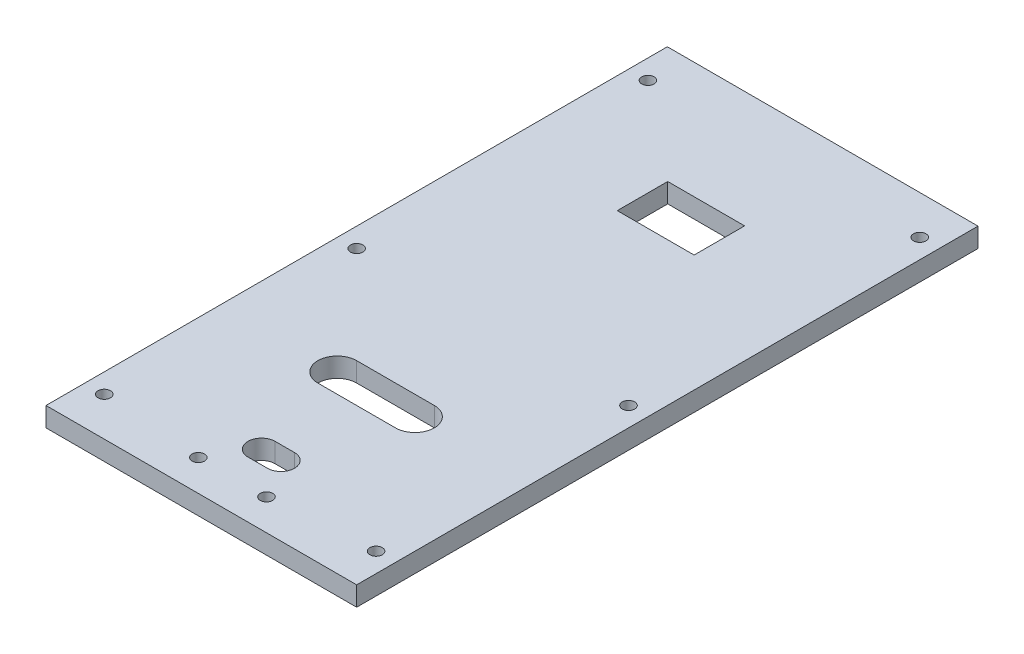
from build123d import *

# Parameters (mm, degrees)
ESQUISSE1_W              = 80
ESQUISSE1_H              = 160
BOSS_EXTRU_1_DEPTH       = 5
ESQUISSE2_R              = 1.6
ENL_V_MAT_EXTRU_8_DEPTH  = 10
ESQUISSE3_W              = 19.8
ESQUISSE3_H              = 13
ENL_V_MAT_EXTRU_9_DEPTH  = 10
ESQUISSE4_R              = 1.6
ENL_V_MAT_EXTRU_10_DEPTH = 10
ENL_V_MAT_EXTRU_11_DEPTH = 179.955301682
ENL_V_MAT_EXTRU_12_DEPTH = 179.955301682


with BuildPart() as part:
    # Esquisse1 → Boss.-Extru.1 (new body)
    with BuildSketch(Plane(origin=(0, 0, 0), x_dir=(1, 0, 0), z_dir=(0, 1, 0))):
        with Locations((40, 80)):
            Rectangle(ESQUISSE1_W, ESQUISSE1_H)
    extrude(amount=BOSS_EXTRU_1_DEPTH)

    # Esquisse2 → Enlèv. mat.-Extru.8 (cut)
    with BuildSketch(Plane(origin=(0, 0, 0), x_dir=(1, 0, 0), z_dir=(0, 1, 0))):
        with Locations(Location((5, 150, 0), (0, 0, 90))):
            Circle(ESQUISSE2_R)
        with Locations(Location((5, 75, 0), (0, 0, 90))):
            Circle(ESQUISSE2_R)
        with Locations(Location((5, 10, 0), (0, 0, 90))):
            Circle(ESQUISSE2_R)
        with Locations(Location((75, 10, 0), (0, 0, 90))):
            Circle(ESQUISSE2_R)
        with Locations(Location((75, 75, 0), (0, 0, 90))):
            Circle(ESQUISSE2_R)
        with Locations(Location((75, 150, 0), (0, 0, 90))):
            Circle(ESQUISSE2_R)
    extrude(amount=ENL_V_MAT_EXTRU_8_DEPTH, mode=Mode.SUBTRACT)

    # Esquisse3 → Enlèv. mat.-Extru.9 (cut)
    with BuildSketch(Plane(origin=(0, 0, 0), x_dir=(1, 0, 0), z_dir=(0, 1, 0))):
        with Locations((40, 123.5)):
            Rectangle(ESQUISSE3_W, ESQUISSE3_H)
    extrude(amount=ENL_V_MAT_EXTRU_9_DEPTH, mode=Mode.SUBTRACT)

    # Esquisse4 → Enlèv. mat.-Extru.10 (cut)
    with BuildSketch(Plane(origin=(0, 5, 0), x_dir=(1, 0, 0), z_dir=(0, 1, 0))):
        with Locations(Location((31.225, 8, 0), (0, 0, 270))):
            Circle(ESQUISSE4_R)
        with Locations(Location((48.775, 8, 0), (0, 0, 90))):
            Circle(ESQUISSE4_R)
    extrude(amount=-ENL_V_MAT_EXTRU_10_DEPTH, mode=Mode.SUBTRACT)

    # Esquisse5 → Enlèv. mat.-Extru.11 (cut, through all)
    with BuildSketch(Plane(origin=(0, 5, 0), x_dir=(1, 0, 0), z_dir=(0, 1, 0))):
        with BuildLine():
            Line((37.5, 21.5), (42.5, 21.5))
            ThreePointArc((42.5, 21.5), (46, 18), (42.5, 14.5))
            Line((42.5, 14.5), (37.5, 14.5))
            ThreePointArc((37.5, 14.5), (34, 18), (37.5, 21.5))
        make_face()
    extrude(amount=-ENL_V_MAT_EXTRU_11_DEPTH, mode=Mode.SUBTRACT)

    # Esquisse6 → Enlèv. mat.-Extru.12 (cut, through all)
    with BuildSketch(Plane(origin=(0, 5, 0), x_dir=(1, 0, 0), z_dir=(0, 1, 0))):
        with BuildLine():
            Line((30, 50), (50, 50))
            ThreePointArc((50, 50), (55, 45), (50, 40))
            Line((50, 40), (30, 40))
            ThreePointArc((30, 40), (25, 45), (30, 50))
        make_face()
    extrude(amount=-ENL_V_MAT_EXTRU_12_DEPTH, mode=Mode.SUBTRACT)


solid = part.part
